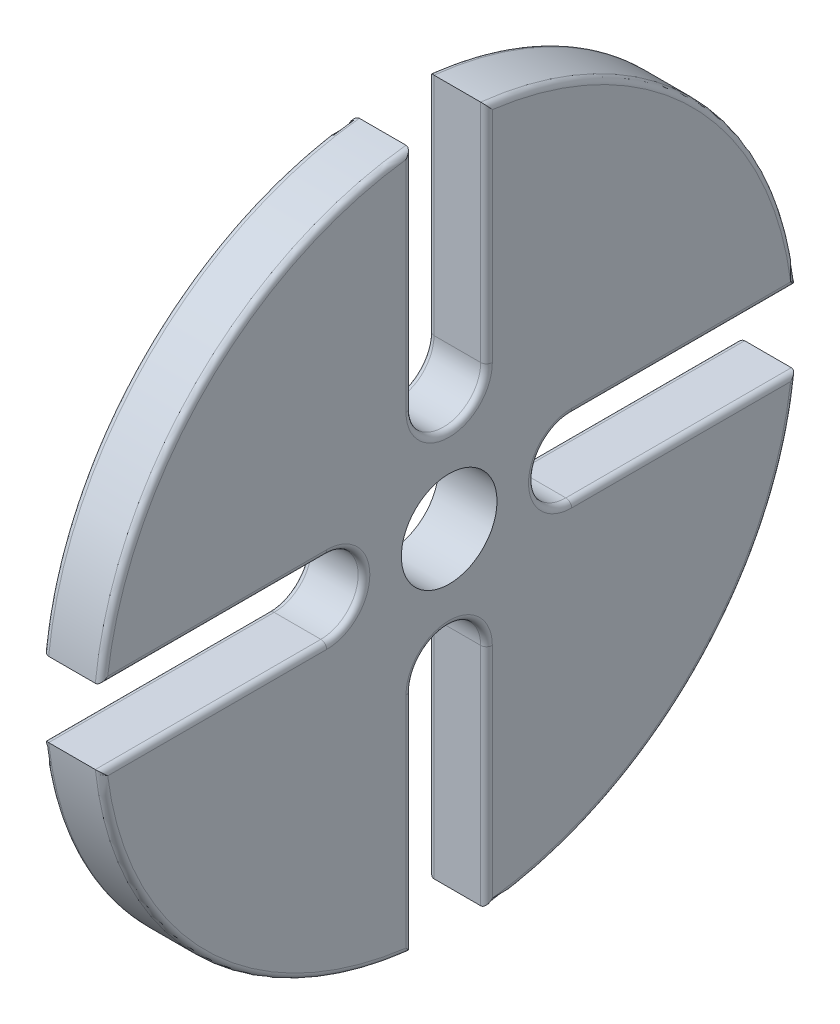
from build123d import *

# Parameters (mm, degrees)
BOSS_EXTRUDE1_DEPTH = 5
CIRPATTERN2_COUNT   = 4
FILLET1_R           = 0.5


with BuildPart() as part:
    # Sketch1 → Boss-Extrude1 (new body)
    with BuildSketch(Plane(origin=(0, 0, 0), x_dir=(0, 0, -1), z_dir=(1, 0, 0))):
        with BuildLine():
            ThreePointArc((21.21320343559647, 21.21320343559638), (12.944436867601569, 27.063657442789903), (3.2000000000000988, 29.82884510000344))
            Line((3.2000000000000006, 29.828845100003434), (3.200000000000003, 10.5))
            ThreePointArc((3.200000000000003, 10.500000000000002), (3.62e-15, 7.300000000000001), (-3.1999999999999966, 10.5))
            Line((-3.1999999999999975, 10.5), (-3.2000000000000006, 29.828845100003434))
            ThreePointArc((-3.200000000000102, 29.82884510000344), (-12.944436867601578, 27.0636574427899), (-21.21320343559647, 21.21320343559638))
            Line((-21.21320343559647, 21.21320343559638), (-2.899137802864851, 2.8991378028648396))
            ThreePointArc((-2.89913780286495, 2.899137802864739), (-1.34e-14, 4.1), (2.8991378028649306, 2.8991378028647583))
            Line((2.8991378028648507, 2.8991378028648387), (21.21320343559647, 21.213203435596384))
        make_face()
    boss_extrude1 = extrude(amount=BOSS_EXTRUDE1_DEPTH)

    # CirPattern2: Boss-Extrude1 ×4 about axis
    cirpattern2_axis = Axis((0, 0, 5.64e-15), (1, 0, 0))
    for i in range(1, CIRPATTERN2_COUNT):
        add(boss_extrude1.rotate(cirpattern2_axis, i * 360 / CIRPATTERN2_COUNT))

    # Fillet1
    fillet1_edges = [part.edges().sort_by_distance(p)[0] for p in [
        (0, 21.213203435596427, -21.213203435596423),
        (5, 20.164422550001717, 3.1999999999999993),
        (0, 21.21320343559643, 21.213203435596437),
        (0, 20.164422550001717, 3.1999999999999993),
        (0, 7.300000000000001, -3.77e-15),
        (5, 21.213203435596434, 21.213203435596416),
        (5, 1.022e-14, 7.300000000000006),
        (5, -3.1999999999999913, 20.164422550001724),
        (0, -21.213203435596427, 21.213203435596437),
        (0, 3.20000000000001, 20.164422550001724),
        (5, -21.21320343559641, 21.21320343559644),
        (5, -20.164422550001717, 3.2000000000000157),
        (5, -21.213203435596434, -21.2132034355964),
        (5, -3.200000000000012, -20.16442255000171),
        (5, 3.20000000000001, 20.164422550001724),
        (0, 1.022e-14, 7.300000000000006),
        (0, 3.199999999999989, -20.16442255000171),
        (0, -1.103e-14, -7.299999999999995),
        (0, -20.164422550001717, -3.1999999999999855),
        (0, -7.300000000000001, 1.595e-14),
        (0, -3.1999999999999913, 20.164422550001724),
        (5, -7.300000000000001, 1.595e-14),
        (5, -20.164422550001717, -3.1999999999999855),
        (0, -21.213203435596434, -21.21320343559642),
        (0, -20.164422550001717, 3.2000000000000157),
        (5, 21.21320343559641, -21.21320343559643),
        (5, -1.103e-14, -7.299999999999995),
        (5, 3.199999999999989, -20.16442255000171),
        (0, -3.200000000000012, -20.16442255000171),
        (5, 20.164422550001717, -3.200000000000002),
        (5, 7.300000000000001, -3.77e-15),
        (0, 20.164422550001717, -3.200000000000002),
    ]]
    fillet(fillet1_edges, radius=FILLET1_R)


solid = part.part
